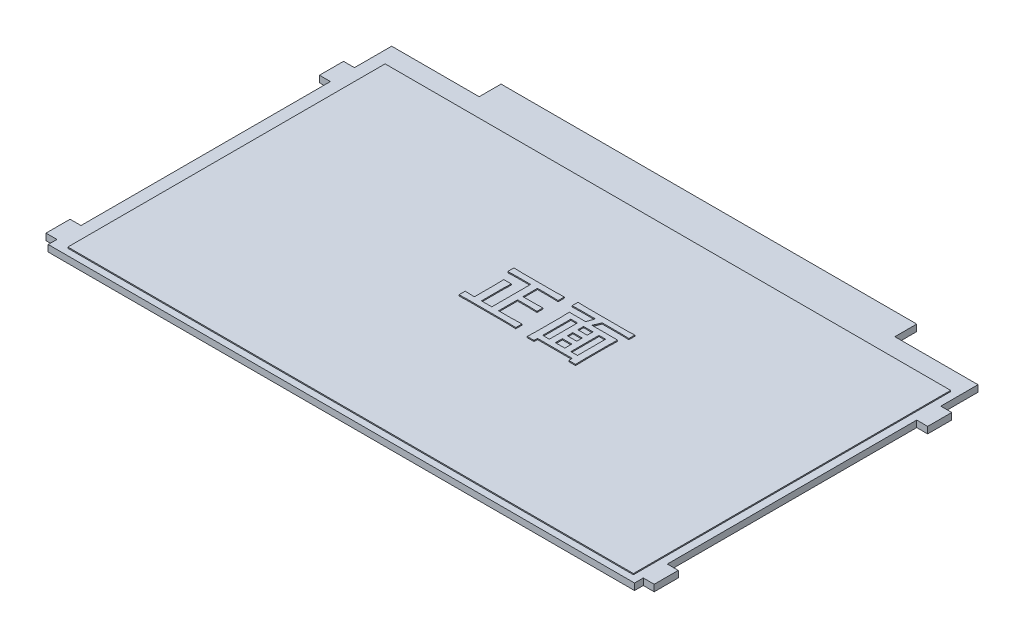
from build123d import *

# Parameters (mm, degrees)
SKETCH1_W           = 268
SKETCH1_H           = 157
SKETCH1_W_2         = 190
SKETCH1_H_2         = 10
SKETCH1_W_3         = 5
SKETCH1_H_3         = 11
BOSS_EXTRUDE1_DEPTH = 3
SKETCH2_W           = 3.043571582
SKETCH2_H           = 12.874007298
SKETCH2_W_2         = 4.292766688
SKETCH2_H_2         = 3.202403949
SKETCH2_H_3         = 2.635758747
SKETCH2_H_4         = 2.519854046
BOSS_EXTRUDE2_DEPTH = 1
SKETCH3_W           = 23
SKETCH3_H           = 10
CUT_EXTRUDE1_DEPTH  = 1
SKETCH4_W           = 258.5
SKETCH4_H           = 145
BOSS_EXTRUDE3_DEPTH = 0.5


with BuildPart() as part:
    # Sketch1 → Boss-Extrude1 (new body)
    with BuildSketch(Plane(origin=(0, 0, 0), x_dir=(1, 0, 0), z_dir=(0, 1, 0))):
        with Locations((134, -78.5)):
            Rectangle(SKETCH1_W, SKETCH1_H)
        with Locations((135, 5)):
            Rectangle(SKETCH1_W_2, SKETCH1_H_2)
        with Locations((-2.5, -147.5)):
            Rectangle(SKETCH1_W_3, SKETCH1_H_3)
        with Locations((-2.5, -22.5)):
            Rectangle(SKETCH1_W_3, SKETCH1_H_3)
        with Locations((270.5, -147.5)):
            Rectangle(SKETCH1_W_3, SKETCH1_H_3)
        with Locations((270.5, -22.5)):
            Rectangle(SKETCH1_W_3, SKETCH1_H_3)
    extrude(amount=BOSS_EXTRUDE1_DEPTH)

    # Sketch2 → Boss-Extrude2 (add)
    # profile 1 of 2: a face of its own
    with BuildSketch(Plane(origin=(0, 3, 0), x_dir=(1, 0, 0), z_dir=(0, 1, 0))):
        with BuildLine():
            add(Edge.make_bspline(
                [(135.307792424, -60.935618418), (136.043394283, -60.929872137), (137.516462167, -60.918365013), (138.988232778, -60.855485851), (139.725049347, -60.824006484)],
                knots=[0, 0, 0, 0, 0.9987345, 2, 2, 2, 2], degree=3))
            Line((139.725049347, -60.824006484), (139.725049347, -63.648646965))
            add(Edge.make_bspline(
                [(139.725049347, -63.648646965), (138.962484758, -63.615374913), (137.414952917, -63.547853343), (135.865976027, -63.537827669), (135.08027579, -63.532742264)],
                knots=[0, 0, 0, 0, 0.985523617, 2, 2, 2, 2], degree=3))
            Line((135.08027579, -63.532742264), (130.169350699, -63.532742264))
            Line((130.169350699, -63.532742264), (130.169350699, -70.152188497))
            Line((130.169350699, -70.152188497), (135.419404358, -70.152188497))
            add(Edge.make_bspline(
                [(135.419404358, -70.152188497), (136.039134717, -70.146727416), (137.284893315, -70.135749758), (138.528942277, -70.069550673), (139.154111377, -70.036283797)],
                knots=[0, 0, 0, 0, 0.994944541, 2, 2, 2, 2], degree=3))
            Line((139.154111377, -70.036283797), (139.154111377, -72.749312343))
            add(Edge.make_bspline(
                [(139.154111377, -72.749312343), (138.516062203, -72.716059404), (137.27196352, -72.65122124), (136.026243624, -72.639242809), (135.419404358, -72.633407643)],
                knots=[0, 0, 0, 0, 1.025721163, 2, 2, 2, 2], degree=3))
            Line((135.419404358, -72.633407643), (130.169350699, -72.633407643))
            Line((130.169350699, -72.633407643), (130.169350699, -81.300503586))
            Line((130.169350699, -81.300503586), (135.419404358, -81.300503586))
            add(Edge.make_bspline(
                [(135.419404358, -81.300503586), (135.838674037, -81.298526084), (136.693002593, -81.294496608), (137.999466804, -81.271486208), (139.356145036, -81.239089408), (140.277424509, -81.202988717), (140.746727818, -81.184598886)],
                knots=[0, 0, 0, 0, 0.944141229, 1.923837697, 2.942394931, 4, 4, 4, 4], degree=3))
            Line((140.746727818, -81.184598886), (140.746727818, -84.009239366))
            add(Edge.make_bspline(
                [(140.746727818, -84.009239366), (140.507775239, -84.000316996), (140.041351217, -83.982900954), (139.360127574, -83.963093217), (138.713441635, -83.940417502), (138.102478659, -83.921722308), (137.524279826, -83.915292518), (136.981961895, -83.907153105), (136.474036272, -83.895501807), (136.147749624, -83.896935696), (135.990342328, -83.897627433)],
                knots=[0, 0, 0, 0, 1.20614788, 2.354343059, 3.437612189, 4.470159218, 5.437450188, 6.354222596, 7.206043603, 8, 8, 8, 8], degree=3))
            Line((135.990342328, -83.897627433), (118.699078108, -83.897627433))
            add(Edge.make_bspline(
                [(118.699078108, -83.897627433), (118.351367046, -83.900165172), (117.670216187, -83.905136494), (116.669672102, -83.91791909), (115.712492767, -83.959882573), (115.088833289, -83.993037721), (114.784074889, -84.009239366)],
                knots=[0, 0, 0, 0, 1.065232275, 2.086743734, 3.06506525, 4, 4, 4, 4], degree=3))
            Line((114.784074889, -84.009239366), (114.784074889, -81.184598886))
            add(Edge.make_bspline(
                [(114.784074889, -81.184598886), (115.084499296, -81.203187074), (115.70220378, -81.241406363), (116.655551752, -81.272609621), (117.660120715, -81.295109806), (118.347056842, -81.298676057), (118.699078108, -81.300503586)],
                knots=[0, 0, 0, 0, 0.922000936, 1.895731827, 2.921665178, 4, 4, 4, 4], degree=3))
            Line((118.699078108, -81.300503586), (119.106890943, -81.300503586))
            Line((119.106890943, -81.300503586), (119.106890943, -71.564508738))
            add(Edge.make_bspline(
                [(119.106890943, -71.564508738), (119.105008601, -71.23252092), (119.101292218, -70.577064058), (119.078929717, -69.611123629), (119.047072355, -68.674984675), (119.009511953, -68.062975408), (118.990986243, -67.761117452)],
                knots=[0, 0, 0, 0, 1.046790456, 2.066720376, 3.046459153, 4, 4, 4, 4], degree=3))
            Line((118.990986243, -67.761117452), (122.433785127, -67.761117452))
            add(Edge.make_bspline(
                [(122.433785127, -67.761117452), (122.415135049, -68.038638933), (122.376128874, -68.619068235), (122.345392922, -69.530988902), (122.323103728, -70.52125442), (122.319664403, -71.208193646), (122.317880426, -71.564508738)],
                knots=[0, 0, 0, 0, 0.876942611, 1.83410374, 2.876550508, 4, 4, 4, 4], degree=3))
            Line((122.317880426, -71.564508738), (122.317880426, -81.300503586))
            Line((122.317880426, -81.300503586), (127.06997315, -81.300503586))
            Line((127.06997315, -81.300503586), (127.06997315, -63.532742264))
            Line((127.06997315, -63.532742264), (120.746727818, -63.532742264))
            add(Edge.make_bspline(
                [(120.746727818, -63.532742264), (120.396138437, -63.534609936), (119.704912714, -63.538292258), (118.68317579, -63.560877789), (117.689817716, -63.592588419), (117.037714938, -63.630120262), (116.715819898, -63.648646965)],
                knots=[0, 0, 0, 0, 1.043121765, 2.056629873, 3.040701518, 4, 4, 4, 4], degree=3))
            Line((116.715819898, -63.648646965), (116.715819898, -60.824006484))
            add(Edge.make_bspline(
                [(116.715819898, -60.824006484), (117.033440101, -60.84074519), (117.679921822, -60.874815025), (118.668847658, -60.907918916), (119.694900582, -60.930036315), (120.391847064, -60.933735047), (120.746727818, -60.935618418)],
                knots=[0, 0, 0, 0, 0.946371587, 1.926237454, 2.944053187, 4, 4, 4, 4], degree=3))
            Line((120.746727818, -60.935618418), (135.307792424, -60.935618418))
        make_face()
    # profile 2 of 2: a face of its own
    with BuildSketch(Plane(origin=(0, 3, 0), x_dir=(1, 0, 0), z_dir=(0, 1, 0))):
        with BuildLine():
            add(Edge.make_bspline(
                [(167.301782551, -59.913939946), (167.891456532, -59.908152644), (169.09857288, -59.896305509), (170.304004331, -59.831290533), (170.920584869, -59.798035245)],
                knots=[0, 0, 0, 0, 0.976996098, 2, 2, 2, 2], degree=3))
            Line((170.920584869, -59.798035245), (170.920584869, -62.511063792))
            add(Edge.make_bspline(
                [(170.920584869, -62.511063792), (170.577212316, -62.492795348), (169.919266524, -62.457790669), (168.973244223, -62.424865862), (168.110365395, -62.401617917), (167.562223339, -62.397239449), (167.301782551, -62.395159092)],
                knots=[0, 0, 0, 0, 1.139511913, 2.183450775, 3.136896165, 4, 4, 4, 4], degree=3))
            Line((167.301782551, -62.395159092), (158.626101074, -62.395159092))
            add(Edge.make_bspline(
                [(158.626101074, -62.395159092), (158.594484063, -62.466645755), (158.523195617, -62.627830288), (158.407141879, -62.899657175), (158.269523471, -63.228108794), (158.11846788, -63.617629985), (157.92884501, -64.057401643), (157.73075781, -64.560317472), (157.50651353, -65.117959616), (157.351018104, -65.508792639), (157.269586801, -65.713467742)],
                knots=[0, 0, 0, 0, 0.523272587, 1.179848703, 1.978605724, 2.907144572, 3.976329277, 5.184142613, 6.525365393, 8, 8, 8, 8], degree=3))
            Line((157.269586801, -65.713467742), (168.98883986, -65.713467742))
            add(Edge.make_bspline(
                [(168.98883986, -65.713467742), (168.955567667, -66.484619362), (168.88780972, -68.055049418), (168.877952196, -69.626916002), (168.872935159, -70.426925565)],
                knots=[0, 0, 0, 0, 0.982089737, 2, 2, 2, 2], degree=3))
            Line((168.872935159, -70.426925565), (168.872935159, -80.210140847))
            add(Edge.make_bspline(
                [(168.872935159, -80.210140847), (168.874764143, -80.636567582), (168.878330279, -81.468010696), (168.900704679, -82.680055241), (168.931863079, -83.823664734), (168.970239794, -84.561633924), (168.98883986, -84.919305904)],
                knots=[0, 0, 0, 0, 1.086169835, 2.117804438, 3.087755123, 4, 4, 4, 4], degree=3))
            Line((168.98883986, -84.919305904), (165.889462311, -84.919305904))
            Line((165.889462311, -84.919305904), (165.889462311, -83.326689463))
            Line((165.889462311, -83.326689463), (149.989054498, -83.326689463))
            Line((149.989054498, -83.326689463), (149.989054498, -84.919305904))
            Line((149.989054498, -84.919305904), (146.889676949, -84.919305904))
            add(Edge.make_bspline(
                [(146.889676949, -84.919305904), (146.898217199, -84.767628066), (146.915940261, -84.452860288), (146.94439141, -83.963706878), (146.957936053, -83.439710841), (146.977122545, -82.881758712), (146.989592229, -82.290741618), (146.996480871, -81.66538604), (147.008054907, -81.005768391), (147.006419844, -80.553567673), (147.00558165, -80.321752781)],
                knots=[0, 0, 0, 0, 0.792670431, 1.644980665, 2.556330883, 3.527379571, 4.557940923, 5.640624323, 6.790496353, 8, 8, 8, 8], degree=3))
            Line((147.00558165, -80.321752781), (147.00558165, -70.199408931))
            add(Edge.make_bspline(
                [(147.00558165, -70.199408931), (146.999806581, -69.468099209), (146.987992845, -67.972099601), (146.922932808, -66.477461623), (146.889676949, -65.713467742)],
                knots=[0, 0, 0, 0, 0.977687049, 2, 2, 2, 2], degree=3))
            Line((146.889676949, -65.713467742), (154.371969286, -65.713467742))
            add(Edge.make_bspline(
                [(154.371969286, -65.713467742), (154.448465415, -65.51911324), (154.594949461, -65.146939716), (154.794264309, -64.610294463), (154.977377555, -64.125317496), (155.130864275, -63.686523404), (155.264784788, -63.296128348), (155.376030325, -62.95257622), (155.468278547, -62.658697834), (155.514515937, -62.47690982), (155.535309059, -62.395159092)],
                knots=[0, 0, 0, 0, 1.424812262, 2.728402969, 3.90518089, 4.961049322, 5.899474943, 6.720602802, 7.424650445, 8, 8, 8, 8], degree=3))
            Line((155.535309059, -62.395159092), (148.645418525, -62.395159092))
            add(Edge.make_bspline(
                [(148.645418525, -62.395159092), (148.359220815, -62.397162224), (147.772445372, -62.401269137), (146.872346745, -62.424186672), (145.929150077, -62.456885957), (145.286989457, -62.49270785), (144.957931939, -62.511063792)],
                knots=[0, 0, 0, 0, 0.93078947, 1.908346519, 2.9281898, 4, 4, 4, 4], degree=3))
            Line((144.957931939, -62.511063792), (144.957931939, -59.798035245))
            add(Edge.make_bspline(
                [(144.957931939, -59.798035245), (145.297008908, -59.816358766), (145.953501821, -59.851835258), (146.906699724, -59.884499167), (147.796770523, -59.907698442), (148.369237311, -59.911908732), (148.645418525, -59.913939946)],
                knots=[0, 0, 0, 0, 1.104356076, 2.138163319, 3.10177442, 4, 4, 4, 4], degree=3))
            Line((148.645418525, -59.913939946), (167.301782551, -59.913939946))
        make_face()
        with Locations((151.510840289, -74.520078602)):
            Rectangle(SKETCH2_W, SKETCH2_H, mode=Mode.SUBTRACT)
        with Locations((164.36767652, -74.520078602)):
            Rectangle(SKETCH2_W, SKETCH2_H, mode=Mode.SUBTRACT)
        with Locations((157.939258404, -79.355880277)):
            Rectangle(SKETCH2_W_2, SKETCH2_H_2, mode=Mode.SUBTRACT)
        with Locations((157.939258404, -69.400954326)):
            Rectangle(SKETCH2_W_2, SKETCH2_H_3, mode=Mode.SUBTRACT)
        with Locations((157.939258404, -74.236756001)):
            Rectangle(SKETCH2_W_2, SKETCH2_H_4, mode=Mode.SUBTRACT)
    extrude(amount=BOSS_EXTRUDE2_DEPTH)

    # Sketch3 → Cut-Extrude1 (cut)
    with BuildSketch(Plane(origin=(0, 0, 0), x_dir=(-1, 0, 0), z_dir=(0, -1, 0))):
        with Locations((-171.5, 5)):
            Rectangle(SKETCH3_W, SKETCH3_H)
    extrude(amount=-CUT_EXTRUDE1_DEPTH, mode=Mode.SUBTRACT)

    # Sketch4 → Boss-Extrude3 (add)
    with BuildSketch(Plane(origin=(0, 3, 0), x_dir=(1, 0, 0), z_dir=(0, 1, 0))):
        with Locations((135.25, -81.5)):
            Rectangle(SKETCH4_W, SKETCH4_H)
    extrude(amount=BOSS_EXTRUDE3_DEPTH)


solid = part.part
